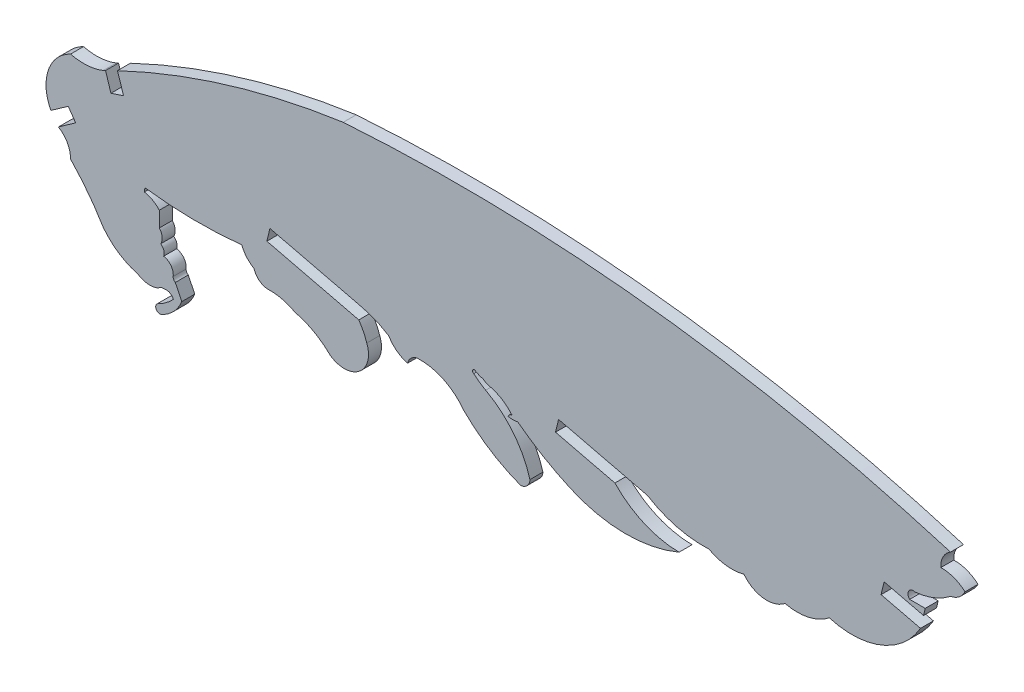
from build123d import *

# Parameters (mm, degrees)
BOSS_EXTRUDE1_DEPTH = 1.524
CUT_EXTRUDE1_DEPTH  = 1.524


with BuildPart() as part:
    # Sketch1 → Boss-Extrude1 (new body)
    with BuildSketch(Plane.XY):
        with BuildLine():
            Line((101.100291423, 60.374270727), (90.656589002, 62.891021845))
            Line((90.656589002, 62.891021845), (90.299552181, 61.409434619))
            Line((90.299552181, 61.409434619), (97.275281594, 59.728404837))
            ThreePointArc((97.275281594, 59.728404837), (100.712861052, 57.330103102), (104.811716554, 56.453640143))
            ThreePointArc((104.811716554, 56.453640143), (98.388387768, 55.183939277), (91.99420693, 56.593103707))
            ThreePointArc((91.99420693, 56.593103707), (88.820887917, 58.243640163), (85.854606826, 60.242489993))
            ThreePointArc((85.854606826, 60.242489993), (85.294961905, 60.16786255), (84.735316985, 60.242489993))
            ThreePointArc((84.735316985, 60.242489993), (84.911389048, 60.485248679), (85.199998696, 60.566720278))
            ThreePointArc((85.199998696, 60.566720278), (84.093704885, 61.559355838), (82.737345027, 62.167220368))
            ThreePointArc((82.737345027, 62.167220368), (82.242631079, 62.293353709), (81.813901616, 62.570558609))
            ThreePointArc((81.813901616, 62.570558609), (81.348307425, 62.709827468), (80.915148386, 62.930161332))
            ThreePointArc((80.915148386, 62.930161332), (80.575687035, 62.892592479), (80.689439461, 62.570558609))
            ThreePointArc((80.689439461, 62.570558609), (81.362910423, 62.034486044), (82.093679171, 61.579608074))
            ThreePointArc((82.093679171, 61.579608074), (85.34723108, 58.853595342), (87.294585764, 55.08204988))
            ThreePointArc((87.294585764, 55.08204988), (86.96715778, 54.308537604), (86.2100149, 53.944855072))
            ThreePointArc((86.2100149, 53.944855072), (82.631314085, 55.737501843), (79.510424358, 58.243640163))
            ThreePointArc((79.510424358, 58.243640163), (77.101022334, 60.220982956), (74.043252382, 60.8252557))
            ThreePointArc((74.043252382, 60.8252557), (73.319039981, 60.442919356), (72.912598281, 59.731955343))
            ThreePointArc((72.912598281, 59.731955343), (71.649210609, 60.355874406), (70.713564157, 61.409434619))
            ThreePointArc((70.713564157, 61.409434619), (69.01653018, 62.293413679), (67.185483534, 62.848941789))
            Line((67.185483534, 62.848941789), (56.741781112, 65.365692908))
            Line((56.741781112, 65.365692908), (56.384744292, 63.884105681))
            Line((56.384744292, 63.884105681), (67.187541645, 61.280818914))
            ThreePointArc((67.187541645, 61.280818914), (67.728064625, 60.371118212), (68.120097106, 59.388249456))
            ThreePointArc((68.120097106, 59.388249456), (67.25174991, 56.088088151), (63.840774779, 55.986401624))
            ThreePointArc((63.840774779, 55.986401624), (61.915192799, 57.442438875), (59.66587196, 58.319060916))
            ThreePointArc((59.66587196, 58.319060916), (58.165438165, 58.903580474), (56.56257634, 59.057848613))
            ThreePointArc((56.56257634, 59.057848613), (55.502751345, 59.425253798), (54.876523852, 60.355874406))
            ThreePointArc((54.876523852, 60.355874406), (54.009369491, 61.07018483), (53.432898123, 62.034486044))
            ThreePointArc((53.432898123, 62.034486044), (47.739513392, 61.768563203), (42.053880875, 62.167220368))
            Line((42.053880875, 62.167220368), (41.993373858, 61.698351986))
            ThreePointArc((41.993373858, 61.698351986), (42.952167328, 61.355476536), (43.743732957, 60.714951479))
            ThreePointArc((43.743732957, 60.714951479), (43.790697856, 59.811147629), (43.743732957, 58.907343779))
            ThreePointArc((43.743732957, 58.907343779), (44.082816136, 58.172570857), (43.912857263, 57.381380215))
            ThreePointArc((43.912857263, 57.381380215), (44.274457866, 56.899495102), (44.262024663, 56.297154937))
            ThreePointArc((44.262024663, 56.297154937), (45.122173078, 55.767110933), (45.378894328, 54.789923059))
            ThreePointArc((45.378894328, 54.789923059), (45.435502491, 54.514155378), (45.627787771, 54.308537604))
            Line((45.627787771, 54.308537604), (46.389355044, 52.737014998))
            ThreePointArc((46.389355044, 52.737014998), (45.400171695, 51.226760005), (43.912857263, 50.203407855))
            ThreePointArc((43.912857263, 50.203407855), (43.364944937, 50.495067499), (43.527258774, 51.094173069))
            ThreePointArc((43.527258774, 51.094173069), (44.526346213, 51.696095286), (45.400171695, 52.468698091))
            ThreePointArc((45.400171695, 52.468698091), (45.003045019, 52.919665256), (44.407834519, 53.00216035))
            ThreePointArc((44.407834519, 53.00216035), (43.983628759, 52.963097784), (43.622570614, 52.737014998))
            ThreePointArc((43.622570614, 52.737014998), (42.399406092, 52.548722507), (41.233267746, 52.963097784))
            ThreePointArc((41.233267746, 52.963097784), (38.971135138, 53.982911867), (37.161424671, 55.680619947))
            ThreePointArc((37.161424671, 55.680619947), (35.381305609, 58.306867343), (33.315602324, 60.714951479))
            ThreePointArc((33.315602324, 60.714951479), (32.966961663, 62.14091635), (31.968277944, 63.216814558))
            ThreePointArc((31.968277944, 63.216814558), (30.501031212, 67.657392256), (33.315602324, 71.392326356))
            ThreePointArc((33.315602324, 71.392326356), (35.258344298, 71.213317676), (37.161424671, 71.642940269))
            ThreePointArc((37.161424671, 71.642940269), (37.296342328, 71.710526901), (37.431371034, 71.777891398))
            Line((37.431371034, 71.777891398), (38.060215392, 69.775819105))
            Line((38.060215392, 69.775819105), (39.550898091, 70.269167956))
            Line((39.550898091, 70.269167956), (38.8265509, 72.457825788))
            ThreePointArc((38.8265509, 72.457825788), (51.785413467, 77.471627923), (65.35310261, 80.469650975))
            ThreePointArc((65.35310261, 80.469650975), (101.39539204, 79.676514857), (136.707899952, 72.416867675))
            ThreePointArc((136.707899952, 72.416867675), (135.835671661, 71.50364664), (135.569556588, 70.269167956))
            ThreePointArc((135.569556588, 70.269167956), (137.092541248, 70.02020814), (138.413889319, 69.223024009))
            ThreePointArc((138.413889319, 69.223024009), (137.71652772, 68.362597164), (136.707899952, 67.905084783))
            ThreePointArc((136.707899952, 67.905084783), (134.733670661, 66.785291795), (132.524956631, 66.262702129))
            ThreePointArc((132.524956631, 66.262702129), (131.786563313, 65.984146711), (131.909656731, 65.204617479))
            Line((131.909656731, 65.204617479), (133.736189305, 65.204617479))
            Line((133.736189305, 65.204617479), (133.535689712, 64.372609071))
            Line((133.535689712, 64.372609071), (128.90572963, 65.488349136))
            Line((128.90572963, 65.488349136), (128.54869281, 64.006761909))
            Line((128.54869281, 64.006761909), (133.178652891, 62.891021845))
            ThreePointArc((133.178652891, 62.891021845), (128.570754882, 58.881474634), (122.468796178, 58.60707916))
            ThreePointArc((122.468796178, 58.60707916), (120.00213942, 57.435104265), (117.271437866, 57.469596916))
            ThreePointArc((117.271437866, 57.469596916), (114.740756953, 56.73361331), (112.440279749, 58.01962357))
            ThreePointArc((112.440279749, 58.01962357), (110.332177288, 57.876927186), (108.32111158, 58.525057544))
            ThreePointArc((108.32111158, 58.525057544), (104.570140962, 58.900802388), (101.100291423, 60.374270727))
        make_face()
    extrude(amount=BOSS_EXTRUDE1_DEPTH)

    # Sketch2 → Cut-Extrude1 (cut)
    with BuildSketch(Plane.XY.offset(1.524)):
        Polygon((31.847119616, 63.233896416), (33.924472638, 64.695472423), (33.047527033, 65.941884236), (30.970174012, 64.480308228), align=None)
    extrude(amount=-CUT_EXTRUDE1_DEPTH, mode=Mode.SUBTRACT)


solid = part.part
